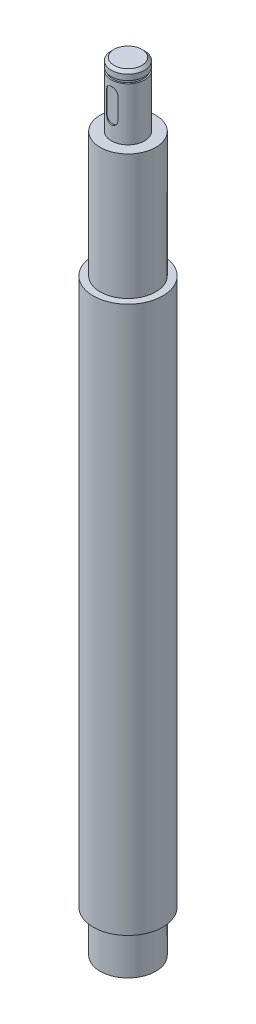
from build123d import *

# Parameters (mm, degrees)
SKETCH_1_R          = 12.5
EXTRUDE_1_DEPTH     = 196.5
SKETCH_2_R          = 10
EXTRUDE_2_DEPTH     = 15
EXTRUDE_START       = 45
SKETCH_3_R          = 10
EXTRUDE_3_DEPTH     = 45
SKETCH_4_R          = 6
EXTRUDE_4_DEPTH     = 23
CUT_EXTRUDE_1_DEPTH = 4
CHAMFER_1_SIZE      = 1
SKETCH_6_W          = 0.5
SKETCH_6_H          = 1


with BuildPart() as part:
    # 草图1 → 凸台-拉伸1 (new body)
    with BuildSketch(Plane(origin=(0, 0, 0), x_dir=(1, 0, 0), z_dir=(0, 1, 0))):
        with Locations(Location((0, 0, 0), (0, 0, 270))):
            Circle(SKETCH_1_R)
    extrude(amount=EXTRUDE_1_DEPTH)

    # 草图2 → 凸台-拉伸2 (add)
    with BuildSketch(Plane.XZ):
        with Locations(Location((0, 0, 0), (0, 0, 270))):
            Circle(SKETCH_2_R)
    extrude(amount=EXTRUDE_2_DEPTH)

    # 草图3 → 凸台-拉伸3 (add)
    with BuildSketch(Plane(origin=(0, 196.5, 0), x_dir=(1, 0, 0), z_dir=(0, 1, 0)).offset(EXTRUDE_START)):
        with Locations(Location((0, 0, 0), (0, 0, 90))):
            Circle(SKETCH_3_R)
    extrude(amount=-EXTRUDE_3_DEPTH)

    # 草图4 → 凸台-拉伸4 (add)
    with BuildSketch(Plane(origin=(0, 241.5, 0), x_dir=(1, 0, 0), z_dir=(0, 1, 0))):
        with Locations(Location((0, 0, 0), (0, 0, 270))):
            Circle(SKETCH_4_R)
    extrude(amount=EXTRUDE_4_DEPTH)

    # 草图5 → 切除-拉伸1 (cut)
    with BuildSketch(Plane(origin=(0, 0, 9.5), x_dir=(-1, 0, 0), z_dir=(0, 0, -1))):
        with BuildLine():
            Line((2, 256.5), (2, 248.5))
            ThreePointArc((2, 248.5), (0, 246.5), (-2, 248.5))
            Line((-2, 248.5), (-2, 256.5))
            ThreePointArc((-2, 256.5), (0, 258.5), (2, 256.5))
        make_face()
    extrude(amount=CUT_EXTRUDE_1_DEPTH, mode=Mode.SUBTRACT)

    # 倒角1
    chamfer_1_edges = [part.edges().sort_by_distance(p)[0] for p in [
        (0, 264.5, -6),
    ]]
    chamfer(chamfer_1_edges, length=CHAMFER_1_SIZE)

    # 草图6 → 切除-旋转1 (revolve, cut)
    with BuildSketch(Plane(origin=(0, 0, 0), x_dir=(0, 0, -1), z_dir=(1, 0, 0))):
        with Locations((5.75, 261)):
            Rectangle(SKETCH_6_W, SKETCH_6_H)
    revolve(axis=Axis((0, 264.5, 0), (0, 1, 0)), mode=Mode.SUBTRACT)


solid = part.part
